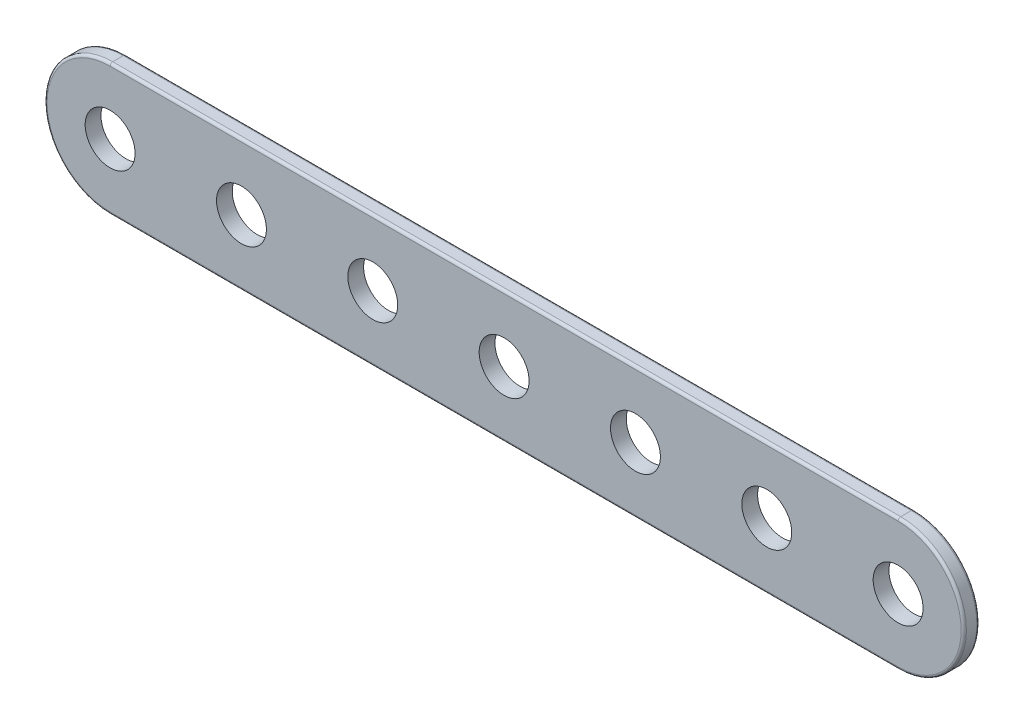
from build123d import *

# Parameters (mm, degrees)
EXTRUDE1_DEPTH  = 1.524
SKETCH2_R       = 2.413
EXTRUDE2_DEPTH  = 45.927136299
LPATTERN1_COUNT = 7
LPATTERN1_PITCH = 12.7
FILLET1_R       = 0.254


with BuildPart() as part:
    # Sketch1 → Extrude1 (new body)
    with BuildSketch(Plane.XY):
        with BuildLine():
            Line((-38.1, -6.35), (38.1, -6.35))
            ThreePointArc((38.1, -6.35), (44.45, 0), (38.1, 6.35))
            Line((38.1, 6.35), (-38.1, 6.35))
            ThreePointArc((-38.1, 6.35), (-44.45, 0), (-38.1, -6.35))
        make_face()
    extrude(amount=EXTRUDE1_DEPTH)

    # Sketch2 → Extrude2 (cut, through all)
    with BuildSketch(Plane.XY.offset(1.524)):
        with Locations((-38.1, 0)):
            Circle(SKETCH2_R)
    extrude2 = extrude(amount=-EXTRUDE2_DEPTH, mode=Mode.SUBTRACT)

    # LPattern1: Extrude2 ×7
    with Locations(*[(i * LPATTERN1_PITCH, 0, 0) for i in range(1, LPATTERN1_COUNT)]):
        add(extrude2, mode=Mode.SUBTRACT)

    # Fillet1
    fillet1_edges = [part.edges().sort_by_distance(p)[0] for p in [
        (-44.45, 0, 1.524),
        (0, -6.35, 1.524),
        (44.45, 0, 1.524),
        (0, -6.35, 0),
        (-44.45, 0, 0),
        (0, 6.35, 0),
        (44.45, 0, 0),
        (0, 6.35, 1.524),
    ]]
    fillet(fillet1_edges, radius=FILLET1_R)


solid = part.part
